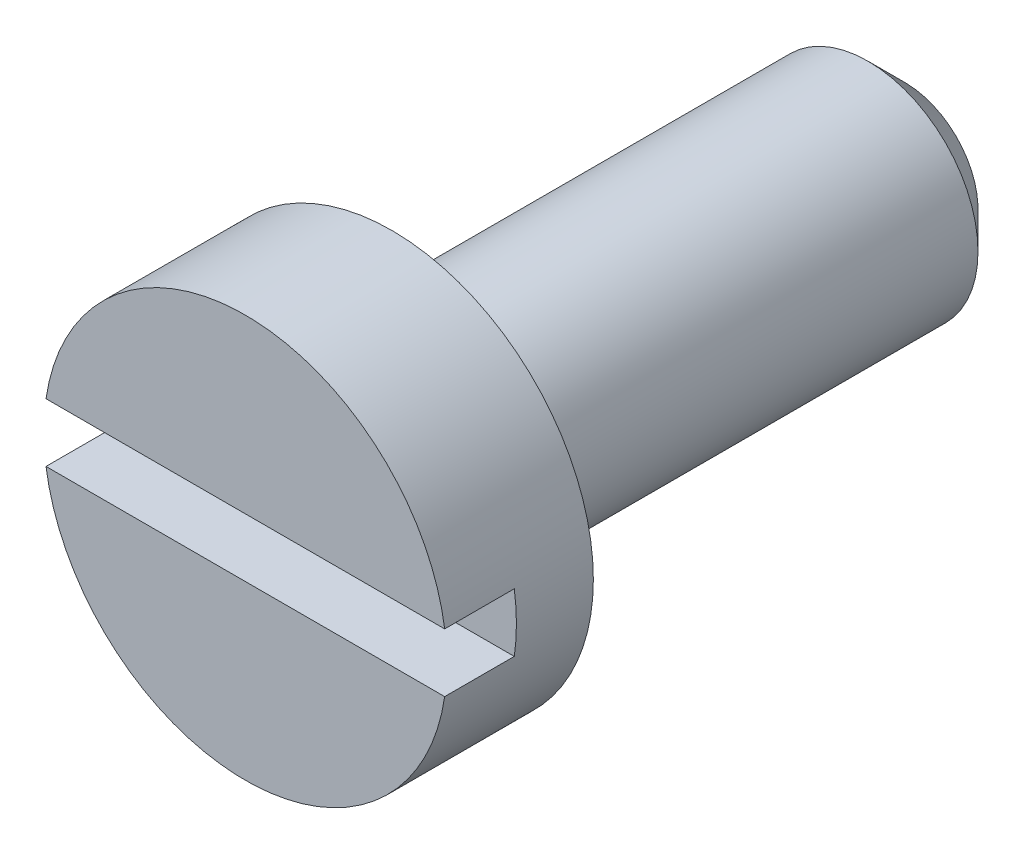
from build123d import *

# Parameters (mm, degrees)
SKETCH_12_R         = 2.75
EXTRUDE_3_DEPTH     = 2
SKETCH_13_R         = 1.5
EXTRUDE_4_DEPTH     = 7
SKETCH_20_W         = 6.034936197
SKETCH_20_H         = 0.8
CUT_EXTRUDE_8_DEPTH = 0.95
CHAMFER_1_SIZE      = 0.5


with BuildPart() as part:
    # Эскиз12 → Вытянуть3 (new body)
    with BuildSketch(Plane.XY):
        Circle(SKETCH_12_R)
    extrude(amount=EXTRUDE_3_DEPTH)

    # Эскиз13 → Вытянуть4 (add)
    with BuildSketch(Plane(origin=(0, 0, 0), x_dir=(-1, 0, 0), z_dir=(0, 0, -1))):
        with Locations(Location((0, 0, 0), (0, 0, 180))):
            Circle(SKETCH_13_R)
    extrude(amount=EXTRUDE_4_DEPTH)

    # Эскиз20 → Вырез-Вытянуть8 (cut)
    with BuildSketch(Plane.XY.offset(2)):
        with Locations((-0.014122315, 0)):
            Rectangle(SKETCH_20_W, SKETCH_20_H)
    extrude(amount=-CUT_EXTRUDE_8_DEPTH, mode=Mode.SUBTRACT)

    # Фаска1
    chamfer_1_edges = [part.edges().sort_by_distance(p)[0] for p in [
        (-1.5, 0, -7),
    ]]
    chamfer(chamfer_1_edges, length=CHAMFER_1_SIZE)


solid = part.part
